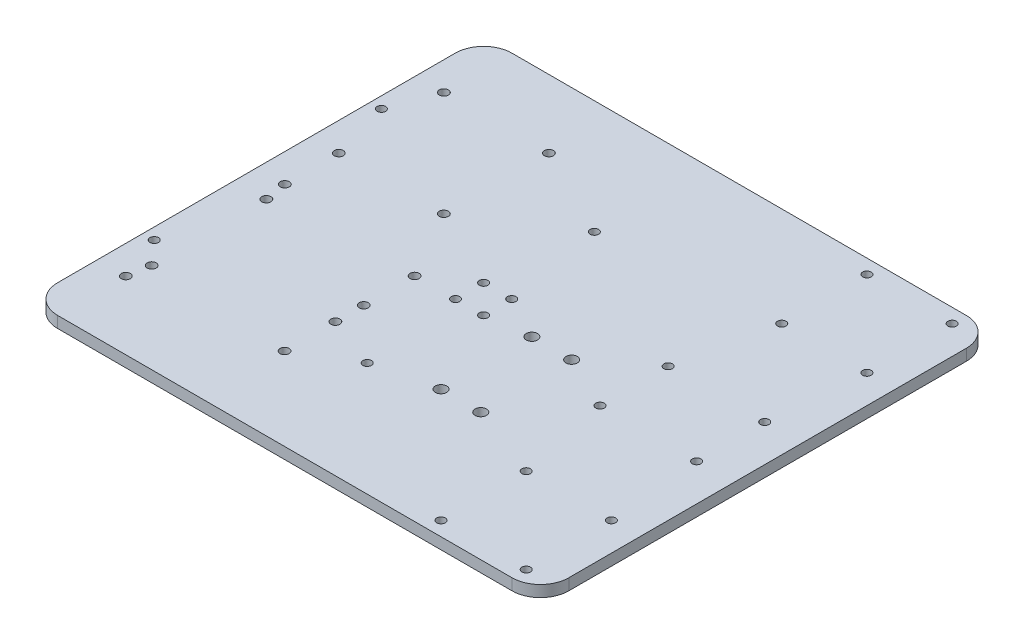
from build123d import *

# Parameters (mm, degrees)
SKETCH_1_W                  = 180
SKETCH_1_H                  = 160
EXTRUDE_1_DEPTH             = 4
SKETCH_4_R                  = 1.6
CUT_EXTRUDE_3_DEPTH         = 4
SKETCH_5_R                  = 1.6
CUT_EXTRUDE_4_DEPTH         = 4
SKETCH_7_R                  = 2
CUT_EXTRUDE_5_DEPTH         = 10
FILLET_1_R                  = 10
SKETCH_8_R                  = 1.5
CUT_EXTRUDE_6_DEPTH         = 10
SKETCH_11_R                 = 1.5
CUT_EXTRUDE_8_DEPTH         = 4
SKETCH_12_R                 = 1.5
CUT_EXTRUDE_9_DEPTH         = 4
SKETCH_13_R                 = 1.5
CUT_EXTRUDE_10_DEPTH        = 10
PATTERN_LINEAR_1_COUNT      = 2
PATTERN_LINEAR_1_PITCH      = 30
PATTERN_LINEAR_1_COUNT_DIR2 = 2
PATTERN_LINEAR_1_PITCH_DIR2 = 30
MIRROR_1_COPY_1_SKETCH_R    = 1.5
MIRROR_1_COPY_1_DEPTH       = 10
MIRROR_1_COPY_2_SKETCH_R    = 1.5
MIRROR_1_COPY_2_DEPTH       = 10
MIRROR_1_COPY_3_SKETCH_R    = 1.5
MIRROR_1_COPY_3_DEPTH       = 10


with BuildPart() as part:
    # 草图1 → 凸台-拉伸1 (new body)
    with BuildSketch(Plane(origin=(0, 0, 0), x_dir=(1, 0, 0), z_dir=(0, 1, 0))):
        Rectangle(SKETCH_1_W, SKETCH_1_H)
    extrude(amount=EXTRUDE_1_DEPTH)

    # 草图4 → 切除-拉伸3 (cut)
    with BuildSketch(Plane(origin=(0, 4, 0), x_dir=(1, 0, 0), z_dir=(0, 1, 0))):
        with Locations(Location((-80, 56, 0), (0, 0, 270))):
            Circle(SKETCH_4_R)
        with Locations(Location((-43, 56, 0), (0, 0, 270))):
            Circle(SKETCH_4_R)
        with Locations(Location((-43, 19, 0), (0, 0, 270))):
            Circle(SKETCH_4_R)
        with Locations(Location((-80, 19, 0), (0, 0, 270))):
            Circle(SKETCH_4_R)
    extrude(amount=-CUT_EXTRUDE_3_DEPTH, mode=Mode.SUBTRACT)

    # 草图5 → 切除-拉伸4 (cut)
    with BuildSketch(Plane(origin=(0, 4, 0), x_dir=(1, 0, 0), z_dir=(0, 1, 0))):
        with Locations(Location((-78.7, -7.8, 0), (0, 0, 270))):
            Circle(SKETCH_5_R)
        with Locations(Location((-29.2, -23, 0), (0, 0, 270))):
            Circle(SKETCH_5_R)
        with Locations(Location((-29.2, -50.9, 0), (0, 0, 270))):
            Circle(SKETCH_5_R)
        with Locations(Location((-80, -56, 0), (0, 0, 270))):
            Circle(SKETCH_5_R)
        with Locations(Location((-29.2, -5.1, 0), (0, 0, 90))):
            Circle(SKETCH_5_R)
        with Locations(Location((-29.2, -33, 0), (0, 0, 90))):
            Circle(SKETCH_5_R)
        with Locations(Location((-80, 0, 0), (0, 0, 90))):
            Circle(SKETCH_5_R)
        with Locations(Location((-78.7, -48.2, 0), (0, 0, 90))):
            Circle(SKETCH_5_R)
    extrude(amount=-CUT_EXTRUDE_4_DEPTH, mode=Mode.SUBTRACT)

    # 草图7 → 切除-拉伸5 (cut)
    with BuildSketch(Plane.XZ):
        with Locations(Location((24, 35, 0), (0, 0, 270))):
            Circle(SKETCH_7_R)
        with Locations(Location((10, 35, 0), (0, 0, 270))):
            Circle(SKETCH_7_R)
        with Locations(Location((24, 3, 0), (0, 0, 270))):
            Circle(SKETCH_7_R)
        with Locations(Location((10, 3, 0), (0, 0, 270))):
            Circle(SKETCH_7_R)
    extrude(amount=-CUT_EXTRUDE_5_DEPTH, mode=Mode.SUBTRACT)

    # 圆角1
    fillet_1_edges = [part.edges().sort_by_distance(p)[0] for p in [
        (90, 2, 80),
        (-90, 2, 80),
        (-90, 2, -80),
        (90, 2, -80),
    ]]
    fillet(fillet_1_edges, radius=FILLET_1_R)

    # 草图8 → 切除-拉伸6 (cut)
    with BuildSketch(Plane.XZ):
        with Locations(Location((-14.949747468, 4.949747468, 0), (0, 0, 270))):
            Circle(SKETCH_8_R)
        with Locations(Location((-5.050252532, 4.949747468, 0), (0, 0, 270))):
            Circle(SKETCH_8_R)
        with Locations(Location((-14.949747468, -4.949747468, 0), (0, 0, 270))):
            Circle(SKETCH_8_R)
        with Locations(Location((-5.050252532, -4.949747468, 0), (0, 0, 270))):
            Circle(SKETCH_8_R)
    extrude(amount=-CUT_EXTRUDE_6_DEPTH, mode=Mode.SUBTRACT)

    # 草图11 → 切除-拉伸8 (cut)
    with BuildSketch(Plane.XZ):
        with Locations(Location((77, 12, 0), (0, 0, 270))):
            Circle(SKETCH_11_R)
        with Locations(Location((43, 12, 0), (0, 0, 90))):
            Circle(SKETCH_11_R)
        with Locations(Location((77, -12, 0), (0, 0, 90))):
            Circle(SKETCH_11_R)
        with Locations(Location((43, -12, 0), (0, 0, 270))):
            Circle(SKETCH_11_R)
    extrude(amount=-CUT_EXTRUDE_8_DEPTH, mode=Mode.SUBTRACT)

    # 草图12 → 切除-拉伸9 (cut)
    with BuildSketch(Plane.XZ):
        with Locations(Location((-86, 40, 0), (0, 0, 270))):
            Circle(SKETCH_12_R)
        with Locations(Location((-11, 40, 0), (0, 0, 270))):
            Circle(SKETCH_12_R)
        with Locations(Location((-11, -40, 0), (0, 0, 270))):
            Circle(SKETCH_12_R)
        with Locations(Location((-86, -40, 0), (0, 0, 270))):
            Circle(SKETCH_12_R)
    extrude(amount=-CUT_EXTRUDE_9_DEPTH, mode=Mode.SUBTRACT)

    # 草图13 → 切除-拉伸10 (cut)
    with BuildSketch(Plane(origin=(0, 4, 0), x_dir=(1, 0, 0), z_dir=(0, 1, 0))):
        with Locations(Location((80, 75, 0), (0, 0, 270))):
            Circle(SKETCH_13_R)
    cut_extrude_10 = extrude(amount=-CUT_EXTRUDE_10_DEPTH, mode=Mode.SUBTRACT)

    # 阵列(线性)1: Cut-Extrude 10 2 × 2
    with Locations(*[(-i * PATTERN_LINEAR_1_PITCH, 0, j * PATTERN_LINEAR_1_PITCH_DIR2) for i in range(PATTERN_LINEAR_1_COUNT) for j in range(PATTERN_LINEAR_1_COUNT_DIR2) if (i, j) != (0, 0)]):
        add(cut_extrude_10, mode=Mode.SUBTRACT)

    # 镜向1: 切除-拉伸10 across plane
    add(cut_extrude_10.mirror(Plane.XY), mode=Mode.SUBTRACT)

    # 镜向1 copy 1 sketch → 镜向1 copy 1 (cut)
    with BuildSketch(Plane(origin=(0, 4, -30), x_dir=(1, 0, 0), z_dir=(0, 1, 0))):
        with Locations((80, -75)):
            Circle(MIRROR_1_COPY_1_SKETCH_R)
    extrude(amount=-MIRROR_1_COPY_1_DEPTH, mode=Mode.SUBTRACT)

    # 镜向1 copy 2 sketch → 镜向1 copy 2 (cut)
    with BuildSketch(Plane(origin=(-30, 4, 0), x_dir=(1, 0, 0), z_dir=(0, 1, 0))):
        with Locations((80, -75)):
            Circle(MIRROR_1_COPY_2_SKETCH_R)
    extrude(amount=-MIRROR_1_COPY_2_DEPTH, mode=Mode.SUBTRACT)

    # 镜向1 copy 3 sketch → 镜向1 copy 3 (cut)
    with BuildSketch(Plane(origin=(-30, 4, -30), x_dir=(1, 0, 0), z_dir=(0, 1, 0))):
        with Locations((80, -75)):
            Circle(MIRROR_1_COPY_3_SKETCH_R)
    extrude(amount=-MIRROR_1_COPY_3_DEPTH, mode=Mode.SUBTRACT)


solid = part.part
